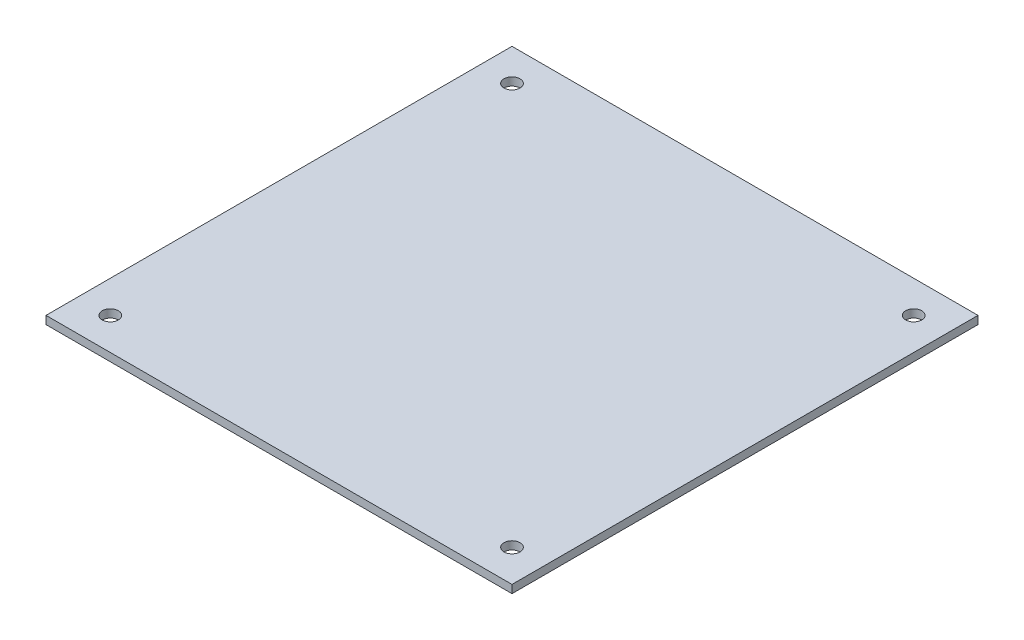
from build123d import *

# Parameters (mm, degrees)
SKETCH1_W           = 145
SKETCH1_H           = 145
SKETCH1_R           = 2.5
BOSS_EXTRUDE1_DEPTH = 2.5


with BuildPart() as part:
    # Sketch1 → Boss-Extrude1 (new body)
    with BuildSketch(Plane(origin=(0, 0, 0), x_dir=(1, 0, 0), z_dir=(0, 1, 0))):
        Rectangle(SKETCH1_W, SKETCH1_H)
        with Locations(Location((-62.5, 62.5, 0), (0, 0, 270))):
            Circle(SKETCH1_R, mode=Mode.SUBTRACT)
        with Locations(Location((62.5, 62.5, 0), (0, 0, 270))):
            Circle(SKETCH1_R, mode=Mode.SUBTRACT)
        with Locations(Location((62.5, -62.5, 0), (0, 0, 270))):
            Circle(SKETCH1_R, mode=Mode.SUBTRACT)
        with Locations(Location((-62.5, -62.5, 0), (0, 0, 270))):
            Circle(SKETCH1_R, mode=Mode.SUBTRACT)
    extrude(amount=BOSS_EXTRUDE1_DEPTH)


solid = part.part
